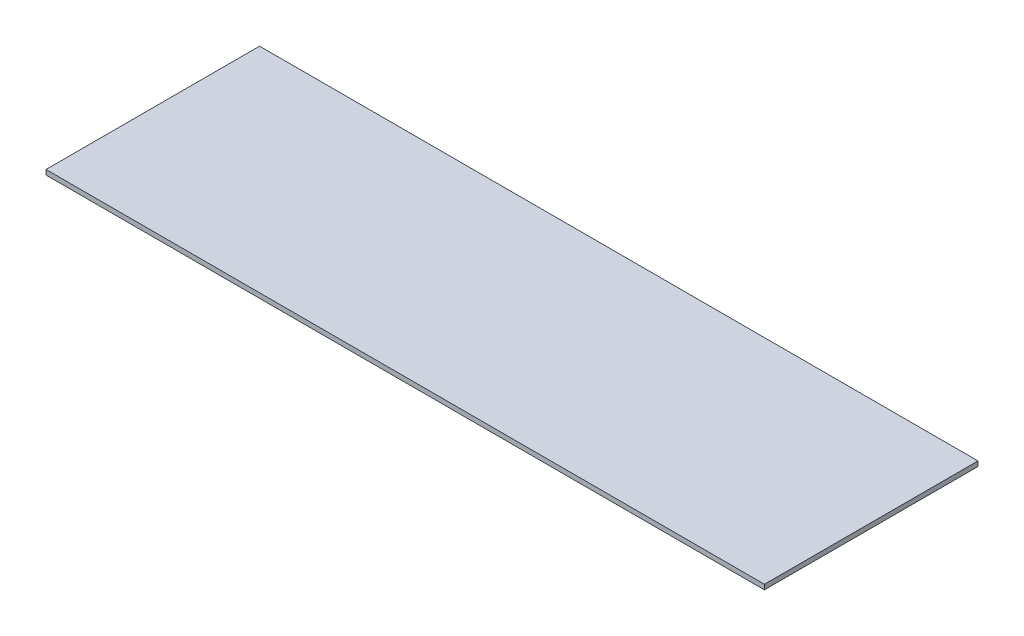
from build123d import *

# Parameters (mm, degrees)
SKETCH1_W           = 234.95
SKETCH1_H           = 69.85
BOSS_EXTRUDE1_DEPTH = 1.5875


with BuildPart() as part:
    # Sketch1 → Boss-Extrude1 (new body)
    with BuildSketch(Plane(origin=(0, 0, 0), x_dir=(1, 0, 0), z_dir=(0, 1, 0))):
        Rectangle(SKETCH1_W, SKETCH1_H)
    extrude(amount=BOSS_EXTRUDE1_DEPTH)


solid = part.part
